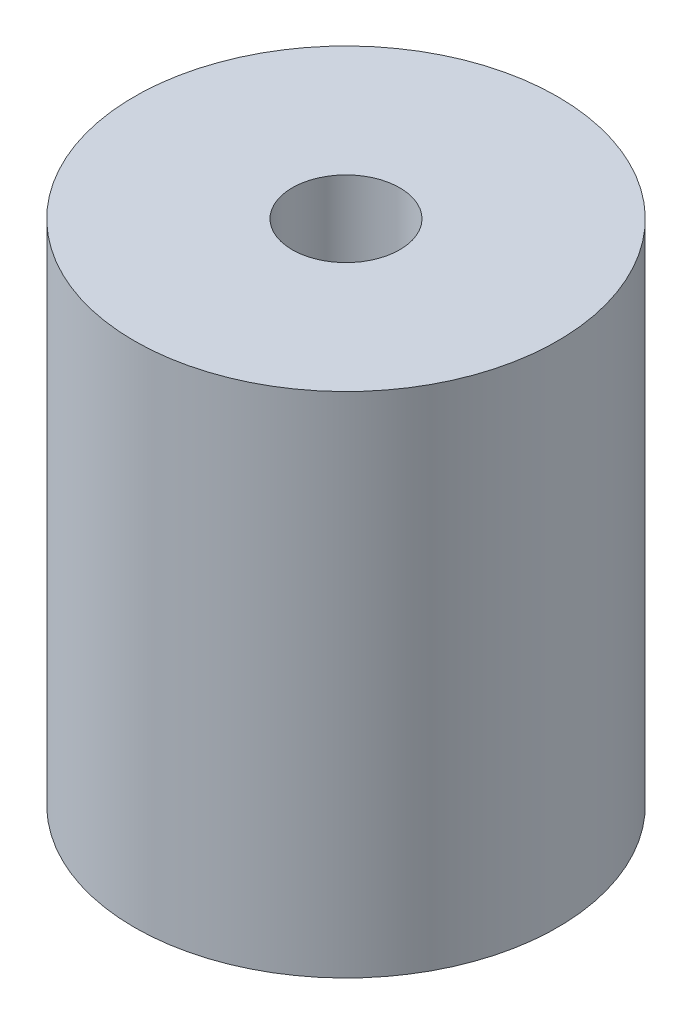
from build123d import *

# Parameters (mm, degrees)
SKETCH1_R           = 12.5
BOSS_EXTRUDE1_DEPTH = 30
SKETCH2_R           = 3.175
CUT_EXTRUDE1_DEPTH  = 12
SKETCH3_R           = 4
CUT_EXTRUDE2_DEPTH  = 12


with BuildPart() as part:
    # Sketch1 → Boss-Extrude1 (new body)
    with BuildSketch(Plane(origin=(0, 0, 0), x_dir=(1, 0, 0), z_dir=(0, 1, 0))):
        with Locations(Location((0, 0, 0), (0, 0, 270))):
            Circle(SKETCH1_R)
    extrude(amount=BOSS_EXTRUDE1_DEPTH)

    # Sketch2 → Cut-Extrude1 (cut)
    with BuildSketch(Plane(origin=(0, 30, 0), x_dir=(1, 0, 0), z_dir=(0, 1, 0))):
        with Locations(Location((0, 0, 0), (0, 0, 270))):
            Circle(SKETCH2_R)
    extrude(amount=-CUT_EXTRUDE1_DEPTH, mode=Mode.SUBTRACT)

    # Sketch3 → Cut-Extrude2 (cut)
    with BuildSketch(Plane.XZ):
        with Locations(Location((0, 0, 0), (0, 0, 270))):
            Circle(SKETCH3_R)
    extrude(amount=-CUT_EXTRUDE2_DEPTH, mode=Mode.SUBTRACT)


solid = part.part
